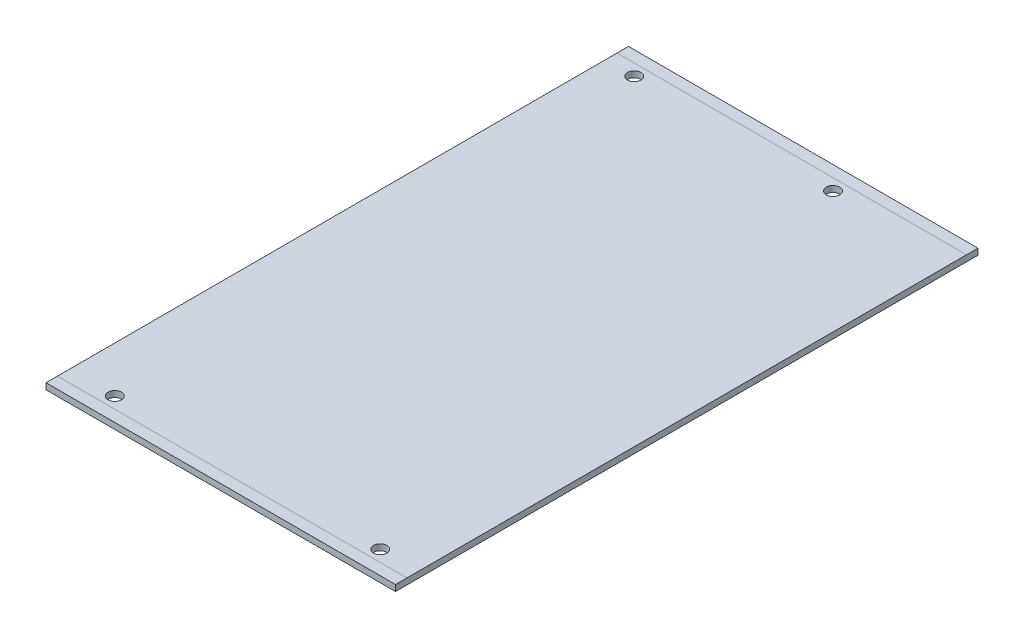
from build123d import *

# Parameters (mm, degrees)
SKETCH1_W           = 91.44
SKETCH1_H           = 152.4
BOSS_EXTRUDE1_DEPTH = 1.6
CUT_EXTRUDE1_REACH  = 90.878
SKETCH2_R           = 1.75
SKETCH3_W           = 91.44
SKETCH3_H           = 3
CUT_EXTRUDE2_DEPTH  = 0.0001


with BuildPart() as part:
    # Sketch1 → Boss-Extrude1 (new body)
    with BuildSketch(Plane(origin=(0, 0, 0), x_dir=(1, 0, 0), z_dir=(0, 1, 0))):
        Rectangle(SKETCH1_W, SKETCH1_H)
    extrude(amount=BOSS_EXTRUDE1_DEPTH)

    # Sketch2 → Cut-Extrude1 (cut, up to next)
    with BuildSketch(Plane(origin=(0, 1.6, 0), x_dir=(1, 0, 0), z_dir=(0, 1, 0)), mode=Mode.PRIVATE) as cut_extrude1_sk1:
        with Locations(Location((-38.22, 70.2, 0), (0, 0, 270))):
            Circle(SKETCH2_R)
    cut_extrude1_tool1 = extrude(cut_extrude1_sk1.sketch, amount=-CUT_EXTRUDE1_REACH, mode=Mode.PRIVATE) & part.part
    # Sketch2 → Cut-Extrude1 (cut, up to next)
    with BuildSketch(Plane(origin=(0, 1.6, 0), x_dir=(1, 0, 0), z_dir=(0, 1, 0)), mode=Mode.PRIVATE) as cut_extrude1_sk2:
        with Locations(Location((-33.72, -70.2, 0), (0, 0, 270))):
            Circle(SKETCH2_R)
    cut_extrude1_tool2 = extrude(cut_extrude1_sk2.sketch, amount=-CUT_EXTRUDE1_REACH, mode=Mode.PRIVATE) & part.part
    # Sketch2 → Cut-Extrude1 (cut, up to next)
    with BuildSketch(Plane(origin=(0, 1.6, 0), x_dir=(1, 0, 0), z_dir=(0, 1, 0)), mode=Mode.PRIVATE) as cut_extrude1_sk3:
        with Locations(Location((35.72, -70.2, 0), (0, 0, 270))):
            Circle(SKETCH2_R)
    cut_extrude1_tool3 = extrude(cut_extrude1_sk3.sketch, amount=-CUT_EXTRUDE1_REACH, mode=Mode.PRIVATE) & part.part
    # Sketch2 → Cut-Extrude1 (cut, up to next)
    with BuildSketch(Plane(origin=(0, 1.6, 0), x_dir=(1, 0, 0), z_dir=(0, 1, 0)), mode=Mode.PRIVATE) as cut_extrude1_sk4:
        with Locations(Location((13.78, 70.2, 0), (0, 0, 270))):
            Circle(SKETCH2_R)
    cut_extrude1_tool4 = extrude(cut_extrude1_sk4.sketch, amount=-CUT_EXTRUDE1_REACH, mode=Mode.PRIVATE) & part.part
    add(cut_extrude1_tool1.solids().sort_by_distance((-38.22, 1.6, -70.2))[0], mode=Mode.SUBTRACT)
    add(cut_extrude1_tool2.solids().sort_by_distance((-33.72, 1.6, 70.2))[0], mode=Mode.SUBTRACT)
    add(cut_extrude1_tool3.solids().sort_by_distance((35.72, 1.6, 70.2))[0], mode=Mode.SUBTRACT)
    add(cut_extrude1_tool4.solids().sort_by_distance((13.78, 1.6, -70.2))[0], mode=Mode.SUBTRACT)

    # Sketch3 → Cut-Extrude2 (cut)
    with BuildSketch(Plane(origin=(0, 1.6, 0), x_dir=(1, 0, 0), z_dir=(0, 1, 0))):
        with Locations((0, 74.7)):
            Rectangle(SKETCH3_W, SKETCH3_H)
        with Locations((0, -74.7)):
            Rectangle(SKETCH3_W, SKETCH3_H)
    extrude(amount=-CUT_EXTRUDE2_DEPTH, mode=Mode.SUBTRACT)


solid = part.part
